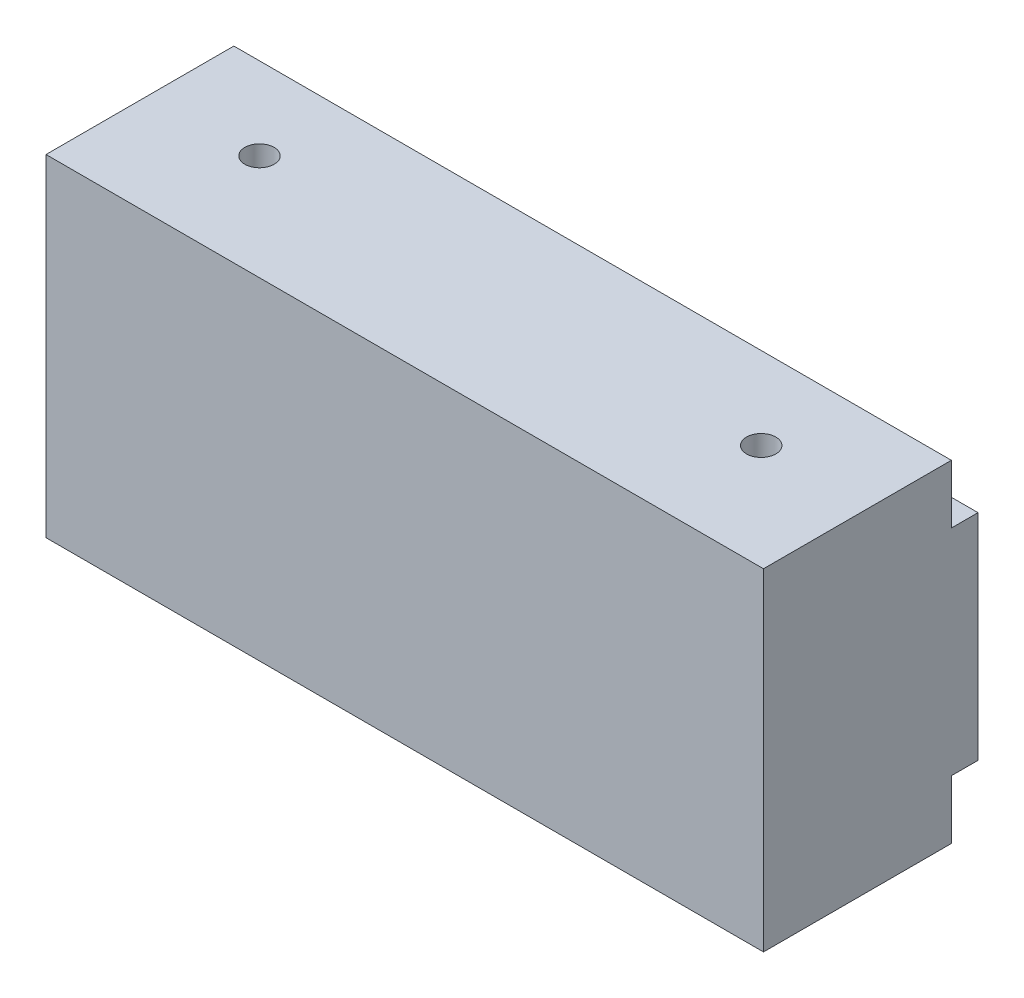
from build123d import *

# Parameters (mm, degrees)
SKETCH1_W           = 310.63946
SKETCH1_H           = 92.869200088
BOSS_EXTRUDE1_DEPTH = 143.6878
SKETCH2_R           = 6.35
CUT_EXTRUDE1_DEPTH  = 355.637485755
SKETCH3_W           = 310.82742
SKETCH3_H           = 12.7
CUT_EXTRUDE2_DEPTH  = 25.4


with BuildPart() as part:
    # Sketch1 → Boss-Extrude1 (new body)
    with BuildSketch(Plane(origin=(0, 0, 0), x_dir=(1, 0, 0), z_dir=(0, 1, 0))):
        with Locations((155.31973, 46.434600044)):
            Rectangle(SKETCH1_W, SKETCH1_H)
    extrude(amount=BOSS_EXTRUDE1_DEPTH)

    # Sketch2 → Cut-Extrude1 (cut, through all)
    with BuildSketch(Plane(origin=(0, 143.6878, 0), x_dir=(1, 0, 0), z_dir=(0, 1, 0))):
        with Locations(Location((46.7106, 45.72, 0), (0, 0, 270))):
            Circle(SKETCH2_R)
        with Locations(Location((263.92886, 45.72, 0), (0, 0, 90))):
            Circle(SKETCH2_R)
    extrude(amount=-CUT_EXTRUDE1_DEPTH, mode=Mode.SUBTRACT)

    # Sketch3 → Cut-Extrude2 (cut)
    with BuildSketch(Plane(origin=(0, 143.6878, 0), x_dir=(1, 0, 0), z_dir=(0, 1, 0))):
        with Locations((155.41371, 87.68842)):
            Rectangle(SKETCH3_W, SKETCH3_H)
    cut_extrude2 = extrude(amount=-CUT_EXTRUDE2_DEPTH, mode=Mode.SUBTRACT)

    # Mirror1: Cut-Extrude2 across plane
    add(cut_extrude2.mirror(Plane.ZX.offset(71.8439)), mode=Mode.SUBTRACT)


solid = part.part
